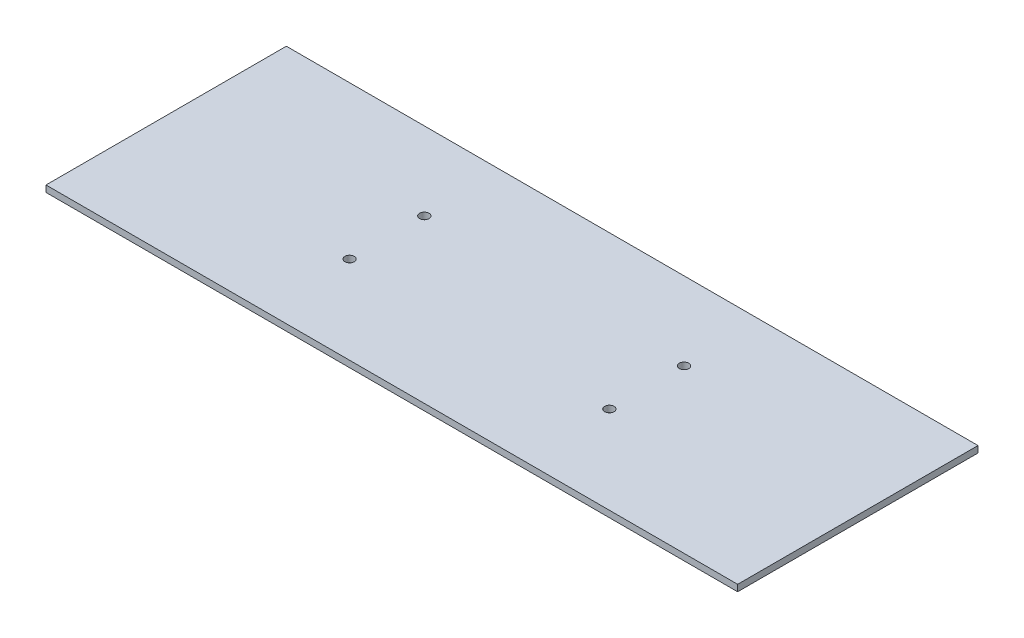
from build123d import *

# Parameters (mm, degrees)
SKETCH1_W           = 213.01
SKETCH1_H           = 74.02
SKETCH1_R           = 1.45
BOSS_EXTRUDE1_DEPTH = 2


with BuildPart() as part:
    # Sketch1 → Boss-Extrude1 (new body)
    with BuildSketch(Plane(origin=(0, 0, 0), x_dir=(1, 0, 0), z_dir=(0, 1, 0))):
        with Locations((0, -1.485783133)):
            Rectangle(SKETCH1_W, SKETCH1_H)
        with Locations(Location((-40, 11.5, 0), (0, 0, 270))):
            Circle(SKETCH1_R, mode=Mode.SUBTRACT)
        with Locations(Location((-40, -11.5, 0), (0, 0, 270))):
            Circle(SKETCH1_R, mode=Mode.SUBTRACT)
        with Locations(Location((40, -11.5, 0), (0, 0, 90))):
            Circle(SKETCH1_R, mode=Mode.SUBTRACT)
        with Locations(Location((40, 11.5, 0), (0, 0, 90))):
            Circle(SKETCH1_R, mode=Mode.SUBTRACT)
    extrude(amount=BOSS_EXTRUDE1_DEPTH)


solid = part.part
